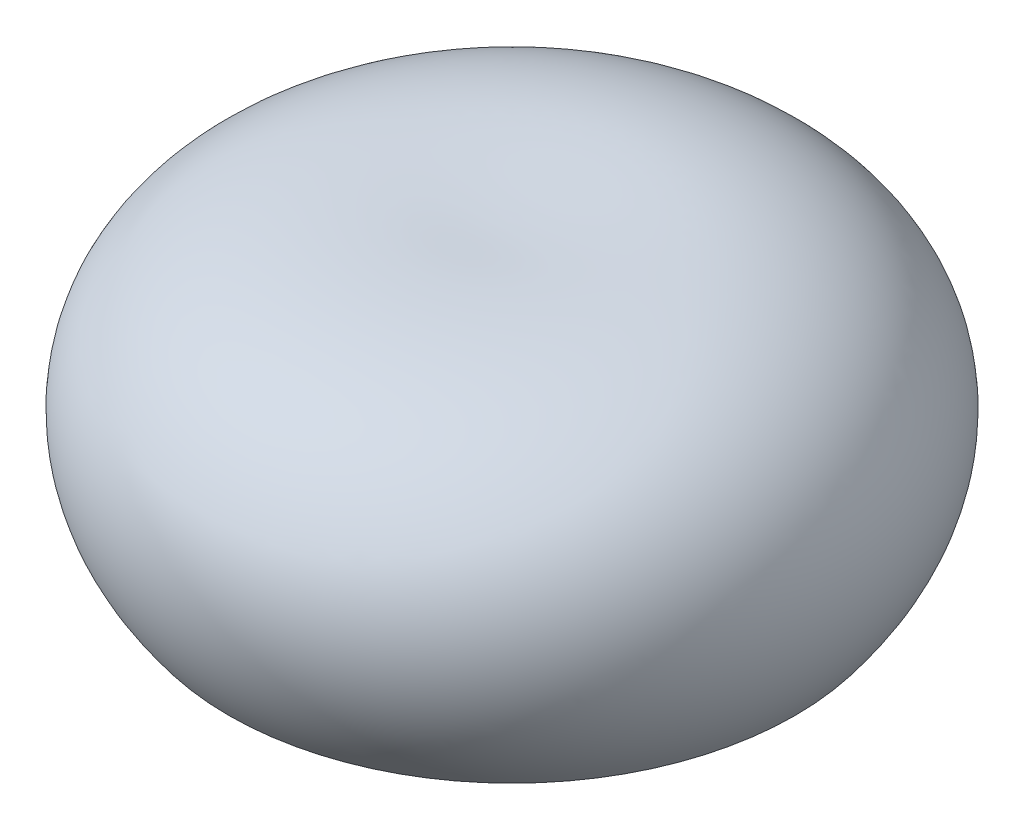
from build123d import *


with BuildPart() as part:
    # 草图1 → 旋转1 (revolve)
    with BuildSketch(Plane.XY):
        with BuildLine():
            Line((0, 7), (0, 0))
            Line((0, 0), (6.831441261, 0))
            add(Edge.make_bspline(
                [(0, 7), (0.073826027, 6.99961248), (0.178309524, 6.999064037), (0.306353289, 7.001245912), (0.380494798, 7.002863842), (0.441570297, 7.004497041), (0.495006805, 7.006121221), (0.543211062, 7.007739734), (0.587527277, 7.009349058), (0.628802834, 7.010947825), (0.667614606, 7.012534752), (0.704377034, 7.01410898), (0.739400045, 7.015669846), (0.772922733, 7.017216861), (0.805134201, 7.018749647), (0.83618711, 7.020267916), (0.866206819, 7.021771443), (0.895297775, 7.023260054), (0.923548095, 7.024733613), (0.951032931, 7.026192009), (0.977816991, 7.027635168), (1.003956462, 7.029063019), (1.029500501, 7.030475521), (1.054492406, 7.031872635), (1.078970545, 7.033254337), (1.10296911, 7.034620614), (1.126518722, 7.035971457), (1.149646932, 7.037306863), (1.172378634, 7.038626836), (1.194736407, 7.039931383), (1.216740809, 7.041220517), (1.238410615, 7.042494251), (1.25976303, 7.0437526), (1.280813862, 7.044995589), (1.301577678, 7.046223234), (1.322067936, 7.047435562), (1.342297094, 7.048632594), (1.362276717, 7.049814357), (1.382017559, 7.050980881), (1.401529643, 7.052132189), (1.420822325, 7.053268312), (1.439904357, 7.054389279), (1.458783938, 7.055495119), (1.477468763, 7.056585861), (1.495966064, 7.057661539), (1.514282646, 7.058722181), (1.532424926, 7.059767819), (1.550398957, 7.060798482), (1.568210462, 7.061814207), (1.585864853, 7.062815017), (1.603367259, 7.063800952), (1.62072254, 7.064772037), (1.637935314, 7.065728308), (1.655009966, 7.066669794), (1.671950667, 7.067596524), (1.68876139, 7.068508536), (1.705445919, 7.069405855), (1.722007866, 7.070288514), (1.738450677, 7.071156547), (1.754777643, 7.072009978), (1.770991912, 7.072848845), (1.787096497, 7.073673172), (1.803094282, 7.074482995), (1.81898803, 7.075278339), (1.834780391, 7.076059237), (1.850473907, 7.076825718), (1.86607102, 7.077577811), (1.881574075, 7.078315544), (1.896985327, 7.079038948), (1.912306943, 7.07974805), (1.927541011, 7.080442881), (1.94268954, 7.081123467), (1.957754466, 7.081789835), (1.972737654, 7.082442017), (1.987640906, 7.083080038), (2.002465956, 7.083703922), (2.017214482, 7.084313704), (2.031888102, 7.084909403), (2.046488381, 7.085491048), (2.06101683, 7.086058669), (2.075474911, 7.086612287), (2.089864039, 7.087151929), (2.104185584, 7.087677622), (2.118440871, 7.088189393), (2.132631183, 7.088687262), (2.146757765, 7.089171256), (2.160821822, 7.089641403), (2.174824525, 7.090097722), (2.188767006, 7.09054024), (2.202650367, 7.09096898), (2.216475676, 7.091383966), (2.23024397, 7.091785222), (2.243956256, 7.092172768), (2.257613513, 7.092546632), (2.271216693, 7.092906831), (2.284766719, 7.093253391), (2.298264492, 7.093586334), (2.311710885, 7.09390568), (2.32510675, 7.094211452), (2.338452915, 7.094503671), (2.351750186, 7.094782357), (2.364999348, 7.095047533), (2.378201166, 7.09529922), (2.391356385, 7.095537436), (2.404465731, 7.095762203), (2.417529911, 7.09597354), (2.430549615, 7.096171469), (2.443525516, 7.096356007), (2.45645827, 7.096527175), (2.469348518, 7.09668499), (2.482196883, 7.096829475), (2.495003975, 7.096960644), (2.50777039, 7.097078519), (2.520496708, 7.097183115), (2.533183498, 7.097274453), (2.545831313, 7.097352551), (2.558440695, 7.097417424), (2.571012173, 7.097469092), (2.583546264, 7.09750757), (2.596043474, 7.097532877), (2.608504298, 7.097545029), (2.620929218, 7.097544042), (2.633318709, 7.097529932), (2.64567323, 7.097502718), (2.657993237, 7.097462414), (2.67027917, 7.097409035), (2.682531464, 7.097342598), (2.694750544, 7.09726312), (2.706936823, 7.097170612), (2.719090708, 7.097065093), (2.731212598, 7.096946574), (2.743302883, 7.096815074), (2.755361945, 7.096670604), (2.767390158, 7.096513182), (2.779387888, 7.096342817), (2.791355496, 7.096159528), (2.803293333, 7.095963325), (2.815201745, 7.095754224), (2.827081071, 7.095532236), (2.838931641, 7.095297379), (2.850753782, 7.095049659), (2.862547814, 7.094789094), (2.874314048, 7.094515696), (2.886052794, 7.094229477), (2.89776435, 7.093930449), (2.909449014, 7.093618625), (2.921107076, 7.093294014), (2.932738821, 7.092956632), (2.944344528, 7.092606489), (2.955924471, 7.092243596), (2.967478921, 7.091867965), (2.979008141, 7.091479607), (2.990512392, 7.091078535), (3.001991929, 7.090664754), (3.013447002, 7.090238283), (3.024877857, 7.089799124), (3.036284736, 7.089347295), (3.047667878, 7.088882802), (3.059027515, 7.088405656), (3.070363877, 7.087915865), (3.081677189, 7.087413443), (3.092967672, 7.086898398), (3.104235546, 7.086370736), (3.115481023, 7.085830472), (3.126704315, 7.085277611), (3.137905628, 7.084712164), (3.149085165, 7.084134138), (3.160243127, 7.083543545), (3.171379711, 7.08294039), (3.18249511, 7.082324685), (3.193589514, 7.081696437), (3.204663111, 7.081055651), (3.215716085, 7.080402341), (3.226748617, 7.079736509), (3.237760886, 7.079058168), (3.248753066, 7.078367321), (3.25972533, 7.077663979), (3.270677849, 7.076948147), (3.28161079, 7.076219835), (3.292524317, 7.075479047), (3.303418592, 7.074725791), (3.314293774, 7.073960076), (3.325150021, 7.073181906), (3.335987487, 7.072391289), (3.346806324, 7.071588229), (3.357606682, 7.070772736), (3.368388709, 7.069944815), (3.379152549, 7.069104471), (3.389898346, 7.068251711), (3.40062624, 7.067386539), (3.411336371, 7.066508962), (3.422028874, 7.065618987), (3.432703885, 7.064716619), (3.443361536, 7.063801859), (3.454001959, 7.062874719), (3.46462528, 7.061935199), (3.475231627, 7.060983306), (3.485821126, 7.060019045), (3.496393899, 7.059042419), (3.506950067, 7.058053435), (3.51748975, 7.057052097), (3.528013066, 7.056038409), (3.53852013, 7.055012375), (3.549011057, 7.053973998), (3.559485961, 7.052923283), (3.569944951, 7.051860236), (3.580388137, 7.050784859), (3.590815628, 7.049697155), (3.60122753, 7.04859713), (3.611623946, 7.047484783), (3.622004982, 7.046360123), (3.632370739, 7.04522315), (3.642721317, 7.044073867), (3.653056816, 7.042912278), (3.663377333, 7.041738386), (3.673682964, 7.040552194), (3.683973805, 7.039353704), (3.694249949, 7.038142919), (3.704511488, 7.036919842), (3.714758514, 7.035684475), (3.724991116, 7.03443682), (3.735209383, 7.033176878), (3.745413403, 7.031904655), (3.75560326, 7.03062015), (3.765779041, 7.029323364), (3.775940829, 7.028014301), (3.786088707, 7.026692964), (3.796222756, 7.025359352), (3.806343057, 7.024013466), (3.816449688, 7.02265531), (3.826542729, 7.021284883), (3.836622256, 7.019902188), (3.846688346, 7.018507226), (3.856741073, 7.017099995), (3.866780512, 7.015680502), (3.876806735, 7.01424874), (3.886819815, 7.012804716), (3.896819824, 7.01134843), (3.90680683, 7.009879879), (3.916780903, 7.008399066), (3.926742113, 7.006905992), (3.936690524, 7.005400655), (3.946626205, 7.003883057), (3.956549222, 7.002353198), (3.966459637, 7.000811077), (3.976357517, 6.999256695), (3.986242922, 6.997690051), (3.996115917, 6.996111144), (4.005976561, 6.994519976), (4.015824916, 6.992916545), (4.02566104, 6.991300851), (4.035484994, 6.989672893), (4.045296834, 6.988032669), (4.055096619, 6.986380181), (4.064884405, 6.984715427), (4.074660248, 6.983038404), (4.084424202, 6.981349114), (4.094176323, 6.979647555), (4.103916663, 6.977933724), (4.113645276, 6.976207622), (4.123362214, 6.974469247), (4.133067528, 6.972718596), (4.142761269, 6.970955668), (4.152443487, 6.969180463), (4.162114232, 6.967392978), (4.171773552, 6.965593212), (4.181421496, 6.963781161), (4.191058111, 6.961956825), (4.200683444, 6.960120203), (4.210297541, 6.958271289), (4.219900448, 6.956410085), (4.229492209, 6.954536586), (4.239072869, 6.95265079), (4.248642473, 6.950752695), (4.258201062, 6.948842299), (4.267748681, 6.946919598), (4.277285369, 6.94498459), (4.286811171, 6.943037272), (4.296326125, 6.941077643), (4.305830272, 6.939105696), (4.315323653, 6.937121433), (4.324806306, 6.935124847), (4.334278271, 6.933115936), (4.343739584, 6.931094697), (4.353190285, 6.929061127), (4.36263041, 6.927015222), (4.372059995, 6.924956978), (4.381479078, 6.922886393), (4.390887692, 6.920803462), (4.400285874, 6.918708182), (4.409673658, 6.916600549), (4.419051079, 6.914480559), (4.42841817, 6.912348208), (4.437774964, 6.910203491), (4.447121494, 6.908046408), (4.456457791, 6.905876949), (4.465783889, 6.903695116), (4.475099817, 6.901500898), (4.484405608, 6.899294297), (4.493701291, 6.897075303), (4.502986897, 6.894843915), (4.512262455, 6.892600126), (4.521527995, 6.890343936), (4.530783544, 6.888075334), (4.540029131, 6.885794319), (4.549264784, 6.883500886), (4.55849053, 6.881195028), (4.567706398, 6.878876743), (4.576912412, 6.876546022), (4.5861086, 6.874202864), (4.595294987, 6.871847261), (4.604471599, 6.869479209), (4.61363846, 6.8670987), (4.622795596, 6.864705731), (4.63194303, 6.862300299), (4.641080787, 6.859882391), (4.65020889, 6.85745201), (4.659327362, 6.855009142), (4.668436227, 6.852553788), (4.677535505, 6.850085939), (4.686625221, 6.847605588), (4.695705394, 6.845112732), (4.704776047, 6.842607362), (4.713837201, 6.840089474), (4.722888876, 6.83755906), (4.731931092, 6.835016114), (4.740963871, 6.832460632), (4.74998723, 6.829892604), (4.75900119, 6.827312027), (4.768005769, 6.824718891), (4.777000986, 6.822113193), (4.785986859, 6.819494921), (4.794963407, 6.816864075), (4.803930647, 6.814220643), (4.812888596, 6.811564621), (4.821837272, 6.808895998), (4.830776691, 6.806214774), (4.839706869, 6.803520935), (4.848627822, 6.800814476), (4.857539568, 6.798095391), (4.866442119, 6.795363672), (4.875335493, 6.792619313), (4.884219704, 6.789862302), (4.893094767, 6.787092637), (4.901960695, 6.784310306), (4.910817504, 6.781515306), (4.919665205, 6.778707625), (4.928503814, 6.775887257), (4.937333343, 6.773054194), (4.946153805, 6.770208428), (4.954965213, 6.767349953), (4.963767579, 6.764478756), (4.972560915, 6.761594835), (4.981345232, 6.758698176), (4.990120543, 6.755788775), (4.998886858, 6.752866623), (5.007644188, 6.74993171), (5.016392546, 6.746984029), (5.025131939, 6.744023569), (5.033862379, 6.741050326), (5.042583876, 6.738064287), (5.051296439, 6.735065448), (5.060000077, 6.732053794), (5.068694801, 6.729029321), (5.077380618, 6.725992018), (5.086057538, 6.722941878), (5.094725569, 6.71987889), (5.103384718, 6.716803044), (5.112034995, 6.713714334), (5.120676405, 6.710612749), (5.129308958, 6.70749828), (5.137932659, 6.704370916), (5.146547516, 6.701230651), (5.155153537, 6.698077474), (5.163750726, 6.694911373), (5.17233909, 6.691732342), (5.180918636, 6.688540369), (5.189489369, 6.685335446), (5.198051295, 6.682117563), (5.206604418, 6.678886708), (5.215148744, 6.675642873), (5.223684278, 6.672386047), (5.232211025, 6.669116222), (5.240728988, 6.665833385), (5.249238171, 6.662537528), (5.25773858, 6.659228639), (5.266230218, 6.65590671), (5.274713087, 6.652571728), (5.283187193, 6.649223684), (5.291652536, 6.645862568), (5.300109121, 6.642488368), (5.308556949, 6.639101074), (5.316996024, 6.635700677), (5.325426348, 6.632287163), (5.333847922, 6.628860523), (5.342260749, 6.625420747), (5.350664829, 6.62196782), (5.359060165, 6.618501737), (5.367446757, 6.615022483), (5.375824607, 6.611530048), (5.384193715, 6.608024418), (5.392554082, 6.604505586), (5.400905709, 6.60097354), (5.409248594, 6.597428265), (5.417582739, 6.593869754), (5.425908142, 6.590297991), (5.434224804, 6.586712969), (5.442532724, 6.583114673), (5.450831901, 6.579503092), (5.459122334, 6.575878214), (5.467404022, 6.572240029), (5.475676964, 6.568588524), (5.483941157, 6.564923686), (5.492196599, 6.561245503), (5.50044329, 6.557553965), (5.508681226, 6.553849056), (5.516910406, 6.550130769), (5.525130826, 6.546399086), (5.533342485, 6.542653999), (5.541545379, 6.538895494), (5.549739504, 6.535123557), (5.557924857, 6.531338176), (5.566101436, 6.527539342), (5.574269235, 6.523727037), (5.582428252, 6.519901252), (5.590578482, 6.516061971), (5.598719922, 6.512209184), (5.606852565, 6.508342875), (5.61497641, 6.504463035), (5.623091449, 6.500569647), (5.631197678, 6.496662699), (5.639295091, 6.492742179), (5.647383684, 6.488808072), (5.655463452, 6.484860367), (5.663534387, 6.480899047), (5.671596486, 6.476924101), (5.679649739, 6.472935514), (5.687694144, 6.468933274), (5.695729692, 6.464917367), (5.703756377, 6.460887777), (5.711774192, 6.456844492), (5.71978313, 6.452787497), (5.727783185, 6.44871678), (5.735774348, 6.444632324), (5.743756613, 6.440534118), (5.751729971, 6.436422145), (5.759694415, 6.432296392), (5.767649937, 6.428156845), (5.775596528, 6.424003489), (5.783534181, 6.41983631), (5.791462886, 6.415655292), (5.799382636, 6.411460423), (5.807293419, 6.407251684), (5.81519523, 6.403029064), (5.823088058, 6.398792549), (5.830971892, 6.394542118), (5.838846725, 6.390277764), (5.846712546, 6.385999466), (5.854569345, 6.381707212), (5.862417112, 6.377400984), (5.870255837, 6.37308077), (5.878085509, 6.368746552), (5.885906118, 6.364398316), (5.893717654, 6.360036046), (5.901520105, 6.355659726), (5.90931346, 6.351269342), (5.917097708, 6.346864875), (5.924872839, 6.342446315), (5.932638837, 6.338013638), (5.940395695, 6.333566835), (5.948143398, 6.329105888), (5.955881936, 6.324630778), (5.963611296, 6.320141494), (5.971331465, 6.315638016), (5.97904243, 6.311120327), (5.98674418, 6.306588415), (5.994436701, 6.302042259), (6.002119979, 6.297481844), (6.009794004, 6.292907155), (6.017458758, 6.288318172), (6.02511423, 6.283714882), (6.032760407, 6.279097266), (6.040397273, 6.274465306), (6.048024816, 6.269818988), (6.05564302, 6.265158293), (6.06325187, 6.260483203), (6.070851354, 6.255793703), (6.078441456, 6.251089774), (6.08602216, 6.246371399), (6.093593452, 6.241638561), (6.101155317, 6.236891242), (6.108707739, 6.232129424), (6.116250702, 6.22735309), (6.123784191, 6.222562222), (6.13130819, 6.217756803), (6.138822681, 6.212936811), (6.146327653, 6.208102235), (6.153823082, 6.203253049), (6.161308958, 6.198389242), (6.16878526, 6.19351079), (6.176251974, 6.188617678), (6.183709081, 6.183709887), (6.191156565, 6.178787397), (6.198594407, 6.173850191), (6.206022591, 6.168898249), (6.213441098, 6.163931553), (6.220849911, 6.158950084), (6.228249012, 6.153953824), (6.235638381, 6.148942751), (6.243018001, 6.143916849), (6.250387854, 6.138876098), (6.25774792, 6.133820477), (6.26509818, 6.128749968), (6.272438616, 6.123664551), (6.279769208, 6.118564209), (6.287089935, 6.113448917), (6.294400781, 6.10831866), (6.301701724, 6.103173416), (6.308992744, 6.098013165), (6.316273821, 6.092837888), (6.323544934, 6.087647564), (6.330806063, 6.082442172), (6.33805719, 6.077221696), (6.345298289, 6.071986108), (6.352529345, 6.066735396), (6.359750331, 6.061469533), (6.36696123, 6.056188501), (6.374162017, 6.050892278), (6.381352675, 6.045580846), (6.388533176, 6.040254179), (6.395703504, 6.034912262), (6.402863633, 6.029555069), (6.410013542, 6.024182581), (6.417153208, 6.018794776), (6.424282608, 6.013391631), (6.431401721, 6.007973128), (6.438510521, 6.002539242), (6.445608988, 5.997089955), (6.452697094, 5.991625239), (6.459774821, 5.98614508), (6.466842141, 5.980649449), (6.473899031, 5.975138327), (6.480945468, 5.969611692), (6.487981427, 5.964069521), (6.495006884, 5.95851179), (6.502021813, 5.95293848), (6.50902619, 5.947349564), (6.51601999, 5.941745023), (6.523003188, 5.936124831), (6.529975758, 5.930488968), (6.536937674, 5.924837409), (6.543888912, 5.91917013), (6.550829444, 5.91348711), (6.557759247, 5.907788324), (6.56467829, 5.902073748), (6.57158655, 5.896343361), (6.578483999, 5.890597136), (6.585370611, 5.884835051), (6.592246357, 5.879057081), (6.599111213, 5.873263203), (6.605965148, 5.867453391), (6.612808137, 5.861627622), (6.619640151, 5.855785872), (6.626461162, 5.849928114), (6.633271142, 5.844054327), (6.640070062, 5.838164483), (6.646857895, 5.832258559), (6.65363461, 5.826336527), (6.66040018, 5.820398366), (6.667154576, 5.814444048), (6.673897766, 5.808473547), (6.680629723, 5.802486841), (6.687350415, 5.7964839), (6.694059815, 5.790464702), (6.700757891, 5.784429218), (6.707444612, 5.778377424), (6.714119949, 5.772309292), (6.72078387, 5.766224797), (6.727436346, 5.760123913), (6.734077343, 5.754006611), (6.740706832, 5.747872867), (6.747324779, 5.741722653), (6.753931155, 5.735555942), (6.760525926, 5.729372706), (6.767109061, 5.72317292), (6.773680527, 5.716956554), (6.780240291, 5.710723583), (6.786788322, 5.704473979), (6.793324585, 5.698207711), (6.799849047, 5.691924755), (6.806361676, 5.685625081), (6.812862436, 5.679308661), (6.819351296, 5.672975467), (6.82582822, 5.66662547), (6.832293173, 5.660258641), (6.838746122, 5.653874952), (6.845187032, 5.647474375), (6.851615868, 5.641056878), (6.858032594, 5.634622434), (6.864437176, 5.628171013), (6.870829578, 5.621702586), (6.877209762, 5.615217122), (6.883577694, 5.608714591), (6.889933338, 5.602194965), (6.896276656, 5.595658212), (6.902607613, 5.589104304), (6.908926169, 5.582533207), (6.915232291, 5.575944892), (6.921525938, 5.569339329), (6.927807074, 5.562716486), (6.93407566, 5.556076332), (6.940331659, 5.549418835), (6.946575032, 5.542743965), (6.95280574, 5.536051689), (6.959023744, 5.529341976), (6.965229006, 5.522614794), (6.971421487, 5.515870111), (6.977601144, 5.509107892), (6.983767942, 5.502328109), (6.989921836, 5.495530725), (6.996062789, 5.488715709), (7.00219076, 5.481883029), (7.008305706, 5.47503265), (7.014407587, 5.468164539), (7.020496364, 5.461278663), (7.026571991, 5.454374986), (7.03263443, 5.447453477), (7.038683638, 5.440514101), (7.04471957, 5.433556822), (7.050742184, 5.426581606), (7.056751441, 5.41958842), (7.062747294, 5.412577226), (7.0687297, 5.405547991), (7.074698615, 5.398500679), (7.080653997, 5.391435254), (7.086595799, 5.384351681), (7.092523978, 5.377249924), (7.09843849, 5.370129945), (7.104339288, 5.36299171), (7.110226328, 5.355835181), (7.116099562, 5.348660321), (7.121958947, 5.341467093), (7.127804434, 5.33425546), (7.133635978, 5.327025384), (7.139453534, 5.319776829), (7.145257051, 5.312509755), (7.151046484, 5.305224124), (7.156821783, 5.297919898), (7.162582904, 5.29059704), (7.168329793, 5.283255507), (7.174062407, 5.275895265), (7.179780693, 5.268516269), (7.185484603, 5.261118484), (7.19117409, 5.253701868), (7.196849099, 5.246266381), (7.202509584, 5.238811984), (7.208155493, 5.231338634), (7.213786775, 5.223846292), (7.219403379, 5.216334916), (7.225005254, 5.208804466), (7.230592346, 5.201254898), (7.236164607, 5.193686173), (7.24172198, 5.186098246), (7.247264415, 5.178491076), (7.252791858, 5.17086462), (7.258304256, 5.163218835), (7.263801554, 5.155553678), (7.269283698, 5.147869105), (7.274750635, 5.140165073), (7.280202309, 5.132441536), (7.285638665, 5.124698453), (7.291059647, 5.116935776), (7.296465199, 5.109153462), (7.301855266, 5.101351464), (7.307229789, 5.093529737), (7.312588712, 5.085688236), (7.31793198, 5.077826914), (7.323259529, 5.069945724), (7.328571308, 5.062044622), (7.333867255, 5.054123557), (7.339147311, 5.046182484), (7.344411415, 5.038221353), (7.349659511, 5.03024012), (7.354891536, 5.022238732), (7.360107432, 5.014217142), (7.365307135, 5.006175301), (7.370490586, 4.99811316), (7.375657723, 4.990030668), (7.380808483, 4.981927776), (7.385942803, 4.973804433), (7.39106062, 4.965660587), (7.396161874, 4.957496189), (7.401246496, 4.949311186), (7.406314425, 4.941105526), (7.411365595, 4.932879156), (7.416399942, 4.924632025), (7.4214174, 4.916364079), (7.426417902, 4.908075264), (7.431401383, 4.899765528), (7.436367773, 4.891434813), (7.441317009, 4.883083068), (7.44624902, 4.874710235), (7.451163738, 4.866316261), (7.456061095, 4.85790109), (7.460941021, 4.849464663), (7.465803446, 4.841006925), (7.470648302, 4.832527819), (7.475475515, 4.824027287), (7.480285016, 4.815505271), (7.485076733, 4.806961712), (7.48985059, 4.79839655), (7.494606521, 4.789809729), (7.499344447, 4.781201186), (7.504064297, 4.772570863), (7.508765993, 4.763918695), (7.513449467, 4.755244626), (7.518114636, 4.74654859), (7.522761429, 4.737830527), (7.527389767, 4.729090373), (7.531999574, 4.720328065), (7.536590772, 4.71154354), (7.541163283, 4.702736733), (7.545717027, 4.693907579), (7.550251926, 4.685056012), (7.5547679, 4.676181967), (7.559264867, 4.667285378), (7.563742748, 4.658366177), (7.568201459, 4.649424296), (7.572640919, 4.640459668), (7.577061042, 4.631472224), (7.581461751, 4.622461894), (7.585842955, 4.613428609), (7.590204571, 4.604372298), (7.594546516, 4.595292891), (7.5988687, 4.586190314), (7.603171038, 4.577064496), (7.607453444, 4.567915364), (7.611715826, 4.558742845), (7.615958098, 4.549546864), (7.620180171, 4.540327347), (7.624381949, 4.531084217), (7.628563348, 4.521817399), (7.632724272, 4.512526815), (7.63686463, 4.503212389), (7.640984331, 4.493874042), (7.645083274, 4.484511694), (7.649161372, 4.475125267), (7.653218524, 4.465714678), (7.657254638, 4.45627985), (7.661269612, 4.446820696), (7.665263355, 4.437337138), (7.66923576, 4.427829089), (7.673186735, 4.418296467), (7.677116175, 4.408739186), (7.68102398, 4.39915716), (7.68491005, 4.389550304), (7.688774278, 4.379918528), (7.692616567, 4.370261746), (7.696436804, 4.360579866), (7.700234889, 4.350872801), (7.704010715, 4.341140458), (7.707764174, 4.331382747), (7.711495158, 4.321599574), (7.715203559, 4.311790846), (7.718889263, 4.301956468), (7.722552163, 4.292096345), (7.726192146, 4.28221038), (7.729809098, 4.272298475), (7.733402908, 4.262360534), (7.736973454, 4.252396454), (7.740520629, 4.242406139), (7.744044308, 4.232389483), (7.747544379, 4.222346387), (7.751020719, 4.212276746), (7.754473208, 4.202180455), (7.757901727, 4.19205741), (7.76130615, 4.181907501), (7.764686357, 4.171730623), (7.76804222, 4.161526665), (7.771373615, 4.151295518), (7.774680415, 4.14103707), (7.77796249, 4.130751209), (7.781219711, 4.120437819), (7.784451948, 4.110096786), (7.787659069, 4.099727995), (7.79084094, 4.089331325), (7.793997427, 4.07890666), (7.797128393, 4.068453878), (7.800233702, 4.057972858), (7.803313213, 4.047463476), (7.80636679, 4.036925609), (7.809394288, 4.02635913), (7.812395566, 4.015763911), (7.815370481, 4.005139825), (7.818318884, 3.99448674), (7.821240631, 3.983804525), (7.824135572, 3.973093046), (7.827003555, 3.962352168), (7.829844432, 3.951581755), (7.832658048, 3.940781669), (7.835444246, 3.929951769), (7.838202873, 3.919091914), (7.84093377, 3.908201962), (7.843636775, 3.897281765), (7.846311728, 3.886331179), (7.848958465, 3.875350054), (7.851576822, 3.86433824), (7.854166632, 3.853295584), (7.856727724, 3.842221932), (7.859259931, 3.831117129), (7.861763079, 3.819981015), (7.864236993, 3.808813431), (7.866681497, 3.797614214), (7.869096413, 3.7863832), (7.87148156, 3.775120223), (7.873836757, 3.763825113), (7.876161817, 3.7524977), (7.878456556, 3.74113781), (7.880720784, 3.729745269), (7.882954312, 3.718319898), (7.885156942, 3.706861517), (7.887328483, 3.695369944), (7.889468735, 3.683844992), (7.891577499, 3.672286475), (7.893654571, 3.660694203), (7.895699747, 3.649067982), (7.897712819, 3.637407617), (7.899693575, 3.625712909), (7.901641805, 3.613983657), (7.903557292, 3.602219657), (7.905439817, 3.590420703), (7.907289162, 3.578586584), (7.9091051, 3.566717086), (7.910887405, 3.554811995), (7.912635851, 3.542871091), (7.914350199, 3.530894151), (7.91603022, 3.51888095), (7.917675669, 3.506831258), (7.91928631, 3.494744842), (7.920861894, 3.482621466), (7.922402172, 3.470460891), (7.923906896, 3.458262873), (7.925375808, 3.446027165), (7.92680865, 3.433753515), (7.928205158, 3.421441669), (7.92956507, 3.409091368), (7.930888111, 3.396702347), (7.93217401, 3.38427434), (7.93342249, 3.371807076), (7.934633269, 3.359300277), (7.935806061, 3.346753663), (7.936940577, 3.33416695), (7.93803652, 3.321539846), (7.939093596, 3.308872058), (7.940111499, 3.296163285), (7.941089923, 3.283413222), (7.942028554, 3.27062156), (7.942927078, 3.257787983), (7.943785171, 3.24491217), (7.944602506, 3.231993794), (7.945378752, 3.219032525), (7.946113571, 3.206028022), (7.946806622, 3.192979944), (7.947457556, 3.179887938), (7.948066016, 3.16675165), (7.948631649, 3.153570715), (7.949154083, 3.140344763), (7.949632952, 3.12707342), (7.950067874, 3.1137563), (7.950458468, 3.100393013), (7.950804339, 3.086983161), (7.951105095, 3.073526339), (7.951360327, 3.060022132), (7.951569625, 3.046470119), (7.951732574, 3.03286987), (7.95184874, 3.019220947), (7.951917698, 3.005522904), (7.951938999, 2.991775283), (7.951912198, 2.97797762), (7.951836834, 2.964129441), (7.951712443, 2.950230261), (7.951538547, 2.936279586), (7.951314664, 2.922276911), (7.951040298, 2.908221721), (7.950714946, 2.894113489), (7.950338097, 2.879951678), (7.949909224, 2.865735739), (7.949427798, 2.851465112), (7.948893271, 2.837139222), (7.948305089, 2.822757483), (7.947662685, 2.808319297), (7.946965479, 2.79382405), (7.946212881, 2.779271115), (7.945404291, 2.764659852), (7.944539088, 2.749989604), (7.943616644, 2.7352597), (7.942636317, 2.720469453), (7.941597449, 2.705618158), (7.940499368, 2.690705095), (7.939341388, 2.675729526), (7.938122804, 2.660690694), (7.936842898, 2.645587824), (7.935500935, 2.63042012), (7.934096162, 2.615186768), (7.932627806, 2.599886933), (7.931095082, 2.584519755), (7.929497177, 2.569084356), (7.927833264, 2.553579833), (7.926102496, 2.538005257), (7.924303998, 2.522359677), (7.922436881, 2.506642114), (7.920500227, 2.490851563), (7.918493099, 2.47498699), (7.91641453, 2.459047331), (7.914263532, 2.443031495), (7.912039084, 2.426938356), (7.909740147, 2.410766757), (7.90736564, 2.394515506), (7.904914466, 2.378183376), (7.902385483, 2.361769102), (7.899777529, 2.345271379), (7.897089394, 2.328688866), (7.894319846, 2.312020174), (7.891467606, 2.295263874), (7.888531363, 2.278418489), (7.885509757, 2.261482494), (7.882401395, 2.244454315), (7.879204834, 2.227332324), (7.875918587, 2.210114836), (7.872541115, 2.192800111), (7.86907083, 2.175386346), (7.865506094, 2.157871675), (7.861845206, 2.140254165), (7.858086412, 2.122531812), (7.854227894, 2.104702538), (7.850267765, 2.086764187), (7.846204078, 2.068714521), (7.842034806, 2.050551215), (7.837757848, 2.032271854), (7.833371027, 2.013873922), (7.828872075, 1.995354807), (7.824258639, 1.976711784), (7.819528268, 1.957942018), (7.814678413, 1.93904255), (7.809706418, 1.920010292), (7.804609514, 1.900842023), (7.79938481, 1.881534374), (7.794029295, 1.862083822), (7.788539812, 1.842486682), (7.782913068, 1.822739092), (7.777145613, 1.802837003), (7.771233831, 1.782776166), (7.765173932, 1.762552117), (7.758961935, 1.742160165), (7.752593661, 1.721595371), (7.746064711, 1.70085253), (7.73937045, 1.679926154), (7.732505999, 1.658810446), (7.725466197, 1.637499277), (7.718245598, 1.61598616), (7.710838434, 1.594264216), (7.70323859, 1.572326145), (7.695439582, 1.550164183), (7.68743451, 1.527770068), (7.679216032, 1.505134986), (7.670776315, 1.482249523), (7.662106992, 1.459103603), (7.653199103, 1.435686425), (7.644043042, 1.411986383), (7.634628477, 1.387990983), (7.624944284, 1.363686743), (7.614978446, 1.33905908), (7.604717954, 1.314092184), (7.594148689, 1.28876886), (7.583255271, 1.263070361), (7.572020914, 1.236976177), (7.560427217, 1.210463798), (7.548453948, 1.18350843), (7.536078766, 1.156082653), (7.52327691, 1.128156017), (7.510020795, 1.099694549), (7.496279544, 1.070660156), (7.482018409, 1.041009885), (7.467198033, 1.010695011), (7.451773557, 0.979659882), (7.43569345, 0.947840457), (7.418898027, 0.915162416), (7.401317504, 0.88153868), (7.382869392, 0.846866107), (7.363454982, 0.811020992), (7.342954436, 0.773852795), (7.321219775, 0.735175152), (7.298064541, 0.694752576), (7.273247917, 0.652279979), (7.246449153, 0.607349576), (7.217223809, 0.559393937), (7.184922391, 0.507579711), (7.148521469, 0.450584621), (7.106203239, 0.386040398), (7.053928975, 0.3085951), (6.962588145, 0.177853211), (6.88558457, 0.073425773), (6.831441261, 0)],
                knots=[0, 0, 0, 0, 0.016508251, 0.023363574, 0.028636216, 0.033091617, 0.037025983, 0.04059109, 0.04387702, 0.046942414, 0.049827967, 0.052563282, 0.055170689, 0.057667517, 0.060067538, 0.062381906, 0.064619804, 0.066788902, 0.068895681, 0.070945675, 0.072943656, 0.07489377, 0.076799649, 0.078664492, 0.080491139, 0.082282118, 0.084039697, 0.085765916, 0.087462619, 0.08913148, 0.090774023, 0.092391639, 0.093985605, 0.095557094, 0.097107186, 0.09863688, 0.1001471, 0.101638706, 0.103112495, 0.104569211, 0.10600955, 0.107434162, 0.108843656, 0.110238603, 0.111619541, 0.112986976, 0.114341384, 0.115683217, 0.117012898, 0.118330831, 0.119637397, 0.120932958, 0.122217857, 0.123492421, 0.12475696, 0.126011769, 0.127257131, 0.128493315, 0.129720577, 0.130939162, 0.132149305, 0.13335123, 0.134545153, 0.13573128, 0.136909808, 0.138080926, 0.139244818, 0.140401657, 0.141551613, 0.142694847, 0.143831516, 0.144961768, 0.14608575, 0.1472036, 0.148315453, 0.14942144, 0.150521684, 0.151616309, 0.15270543, 0.153789161, 0.154867612, 0.155940888, 0.157009093, 0.158072325, 0.159130682, 0.160184256, 0.161233138, 0.162277417, 0.163317176, 0.1643525, 0.165383468, 0.166410158, 0.167432647, 0.168451008, 0.169465312, 0.17047563, 0.17148203, 0.172484577, 0.173483335, 0.174478368, 0.175469736, 0.176457499, 0.177441714, 0.178422438, 0.179399726, 0.180373632, 0.181344207, 0.182311504, 0.183275571, 0.184236458, 0.185194213, 0.18614888, 0.187100506, 0.188049136, 0.188994811, 0.189937576, 0.19087747, 0.191814535, 0.192748809, 0.193680333, 0.194609143, 0.195535276, 0.19645877, 0.197379659, 0.198297978, 0.199213761, 0.200127042, 0.201037853, 0.201946226, 0.202852193, 0.203755784, 0.204657029, 0.205555959, 0.206452602, 0.207346986, 0.208239139, 0.209129089, 0.210016863, 0.210902486, 0.211785985, 0.212667385, 0.213546711, 0.214423987, 0.215299238, 0.216172487, 0.217043757, 0.217913071, 0.218780451, 0.219645919, 0.220509497, 0.221371207, 0.222231068, 0.223089102, 0.223945328, 0.224799767, 0.225652438, 0.22650336, 0.227352552, 0.228200033, 0.22904582, 0.229889932, 0.230732387, 0.231573202, 0.232412394, 0.23324998, 0.234085976, 0.234920399, 0.235753266, 0.236584591, 0.237414391, 0.23824268, 0.239069475, 0.23989479, 0.240718639, 0.241541037, 0.242361999, 0.243181539, 0.24399967, 0.244816406, 0.245631761, 0.246445748, 0.247258379, 0.248069669, 0.248879629, 0.249688273, 0.250495612, 0.251301659, 0.252106427, 0.252909926, 0.253712168, 0.254513166, 0.255312931, 0.256111473, 0.256908805, 0.257704937, 0.25849988, 0.259293644, 0.260086241, 0.26087768, 0.261667972, 0.262457128, 0.263245156, 0.264032068, 0.264817873, 0.265602581, 0.266386201, 0.267168742, 0.267950215, 0.268730627, 0.26950999, 0.27028831, 0.271065598, 0.271841862, 0.272617111, 0.273391353, 0.274164597, 0.274936852, 0.275708125, 0.276478425, 0.277247759, 0.278016137, 0.278783566, 0.279550053, 0.280315607, 0.281080235, 0.281843945, 0.282606744, 0.283368639, 0.284129639, 0.28488975, 0.28564898, 0.286407335, 0.287164823, 0.287921451, 0.288677225, 0.289432153, 0.290186241, 0.290939495, 0.291691923, 0.292443531, 0.293194325, 0.293944313, 0.294693499, 0.295441891, 0.296189495, 0.296936317, 0.297682363, 0.298427639, 0.29917215, 0.299915904, 0.300658906, 0.301401162, 0.302142677, 0.302883457, 0.303623508, 0.304362835, 0.305101445, 0.305839342, 0.306576532, 0.30731302, 0.308048812, 0.308783913, 0.309518328, 0.310252063, 0.310985123, 0.311717512, 0.312449236, 0.3131803, 0.313910709, 0.314640467, 0.31536958, 0.316098053, 0.316825891, 0.317553097, 0.318279677, 0.319005636, 0.319730978, 0.320455708, 0.321179831, 0.32190335, 0.322626271, 0.323348598, 0.324070336, 0.324791488, 0.32551206, 0.326232055, 0.326951478, 0.327670332, 0.328388624, 0.329106355, 0.329823532, 0.330540157, 0.331256236, 0.331971771, 0.332686767, 0.333401229, 0.334115159, 0.334828562, 0.335541443, 0.336253804, 0.33696565, 0.337676984, 0.338387811, 0.339098134, 0.339807957, 0.340517283, 0.341226117, 0.341934462, 0.342642321, 0.343349699, 0.344056599, 0.344763024, 0.345468979, 0.346174466, 0.346879489, 0.347584052, 0.348288158, 0.34899181, 0.349695012, 0.350397768, 0.351100081, 0.351801953, 0.352503389, 0.353204392, 0.353904965, 0.354605111, 0.355304834, 0.356004137, 0.356703023, 0.357401495, 0.358099556, 0.35879721, 0.35949446, 0.360191309, 0.360887759, 0.361583815, 0.362279479, 0.362974754, 0.363669643, 0.36436415, 0.365058277, 0.365752027, 0.366445403, 0.367138409, 0.367831047, 0.36852332, 0.369215231, 0.369906783, 0.370597978, 0.37128882, 0.371979312, 0.372669456, 0.373359255, 0.374048713, 0.374737831, 0.375426612, 0.37611506, 0.376803177, 0.377490966, 0.37817843, 0.378865571, 0.379552391, 0.380238895, 0.380925084, 0.381610961, 0.382296529, 0.38298179, 0.383666747, 0.384351403, 0.385035761, 0.385719822, 0.386403589, 0.387087066, 0.387770254, 0.388453157, 0.389135776, 0.389818115, 0.390500176, 0.391181961, 0.391863473, 0.392544714, 0.393225687, 0.393906395, 0.39458684, 0.395267024, 0.39594695, 0.39662662, 0.397306037, 0.397985203, 0.398664121, 0.399342793, 0.400021221, 0.400699408, 0.401377357, 0.402055069, 0.402732547, 0.403409794, 0.404086811, 0.404763602, 0.405440168, 0.406116513, 0.406792637, 0.407468544, 0.408144236, 0.408819716, 0.409494985, 0.410170046, 0.410844901, 0.411519553, 0.412194003, 0.412868255, 0.41354231, 0.414216171, 0.41488984, 0.415563319, 0.416236611, 0.416909718, 0.417582642, 0.418255385, 0.41892795, 0.419600339, 0.420272553, 0.420944597, 0.42161647, 0.422288177, 0.422959719, 0.423631098, 0.424302316, 0.424973377, 0.425644281, 0.426315032, 0.426985631, 0.42765608, 0.428326383, 0.42899654, 0.429666555, 0.430336429, 0.431006165, 0.431675764, 0.43234523, 0.433014564, 0.433683769, 0.434352845, 0.435021797, 0.435690626, 0.436359334, 0.437027923, 0.437696396, 0.438364755, 0.439033001, 0.439701138, 0.440369167, 0.44103709, 0.44170491, 0.442372628, 0.443040248, 0.443707771, 0.444375199, 0.445042534, 0.445709779, 0.446376936, 0.447044007, 0.447710995, 0.4483779, 0.449044726, 0.449711475, 0.450378149, 0.451044749, 0.451711279, 0.452377741, 0.453044136, 0.453710466, 0.454376735, 0.455042944, 0.455709095, 0.456375191, 0.457041233, 0.457707224, 0.458373167, 0.459039062, 0.459704913, 0.460370722, 0.46103649, 0.461702221, 0.462367916, 0.463033577, 0.463699207, 0.464364808, 0.465030382, 0.465695931, 0.466361458, 0.467026964, 0.467692453, 0.468357925, 0.469023384, 0.469688832, 0.47035427, 0.471019702, 0.471685129, 0.472350554, 0.473015978, 0.473681405, 0.474346836, 0.475012273, 0.47567772, 0.476343178, 0.477008649, 0.477674136, 0.478339641, 0.479005166, 0.479670714, 0.480336286, 0.481001886, 0.481667516, 0.482333177, 0.482998872, 0.483664604, 0.484330375, 0.484996187, 0.485662042, 0.486327943, 0.486993892, 0.487659892, 0.488325944, 0.488992052, 0.489658218, 0.490324443, 0.490990731, 0.491657084, 0.492323504, 0.492989993, 0.493656555, 0.494323191, 0.494989904, 0.495656696, 0.49632357, 0.496990528, 0.497657573, 0.498324707, 0.498991932, 0.499659252, 0.500326668, 0.500994183, 0.5016618, 0.502329521, 0.502997348, 0.503665285, 0.504333333, 0.505001496, 0.505669775, 0.506338174, 0.507006695, 0.50767534, 0.508344112, 0.509013014, 0.509682049, 0.510351218, 0.511020525, 0.511689972, 0.512359562, 0.513029297, 0.513699181, 0.514369215, 0.515039403, 0.515709747, 0.516380251, 0.517050916, 0.517721745, 0.518392742, 0.519063908, 0.519735248, 0.520406763, 0.521078456, 0.52175033, 0.522422388, 0.523094633, 0.523767067, 0.524439694, 0.525112516, 0.525785536, 0.526458757, 0.527132183, 0.527805815, 0.528479657, 0.529153711, 0.529827982, 0.530502471, 0.531177181, 0.531852116, 0.532527279, 0.533202673, 0.5338783, 0.534554164, 0.535230268, 0.535906615, 0.536583208, 0.53726005, 0.537937144, 0.538614493, 0.539292101, 0.539969971, 0.540648106, 0.541326508, 0.542005183, 0.542684131, 0.543363358, 0.544042865, 0.544722657, 0.545402737, 0.546083107, 0.546763772, 0.547444735, 0.548125999, 0.548807567, 0.549489443, 0.55017163, 0.550854132, 0.551536953, 0.552220095, 0.552903562, 0.553587358, 0.554271486, 0.55495595, 0.555640753, 0.5563259, 0.557011393, 0.557697236, 0.558383433, 0.559069988, 0.559756904, 0.560444185, 0.561131835, 0.561819858, 0.562508256, 0.563197035, 0.563886198, 0.564575749, 0.565265692, 0.56595603, 0.566646768, 0.567337909, 0.568029458, 0.568721418, 0.569413794, 0.570106589, 0.570799808, 0.571493455, 0.572187533, 0.572882048, 0.573577002, 0.574272401, 0.574968249, 0.575664549, 0.576361306, 0.577058525, 0.57775621, 0.578454364, 0.579152994, 0.579852102, 0.580551693, 0.581251772, 0.581952344, 0.582653412, 0.583354982, 0.584057058, 0.584759644, 0.585462746, 0.586166368, 0.586870514, 0.58757519, 0.5882804, 0.588986149, 0.589692442, 0.590399283, 0.591106678, 0.591814632, 0.592523149, 0.593232235, 0.593941895, 0.594652133, 0.595362955, 0.596074366, 0.596786371, 0.597498975, 0.598212184, 0.598926003, 0.599640438, 0.600355493, 0.601071174, 0.601787486, 0.602504436, 0.603222028, 0.603940268, 0.604659162, 0.605378715, 0.606098933, 0.606819822, 0.607541388, 0.608263636, 0.608986572, 0.609710203, 0.610434533, 0.61115957, 0.611885319, 0.612611786, 0.613338978, 0.6140669, 0.61479556, 0.615524962, 0.616255114, 0.616986021, 0.617717691, 0.61845013, 0.619183344, 0.619917339, 0.620652124, 0.621387703, 0.622124085, 0.622861275, 0.623599281, 0.624338109, 0.625077767, 0.625818261, 0.626559598, 0.627301787, 0.628044833, 0.628788745, 0.629533529, 0.630279192, 0.631025743, 0.631773189, 0.632521537, 0.633270795, 0.634020971, 0.634772072, 0.635524106, 0.636277082, 0.637031006, 0.637785888, 0.638541735, 0.639298555, 0.640056357, 0.640815149, 0.641574939, 0.642335736, 0.643097548, 0.643860385, 0.644624254, 0.645389164, 0.646155124, 0.646922144, 0.647690232, 0.648459398, 0.649229649, 0.650000997, 0.65077345, 0.651547017, 0.652321708, 0.653097533, 0.653874501, 0.654652623, 0.655431908, 0.656212365, 0.656994006, 0.657776841, 0.658560879, 0.659346131, 0.660132607, 0.660920319, 0.661709277, 0.662499491, 0.663290972, 0.664083733, 0.664877782, 0.665673133, 0.666469796, 0.667267783, 0.668067105, 0.668867774, 0.669669802, 0.670473201, 0.671277983, 0.67208416, 0.672891744, 0.673700749, 0.674511186, 0.675323068, 0.676136408, 0.67695122, 0.677767515, 0.678585309, 0.679404613, 0.680225443, 0.68104781, 0.68187173, 0.682697217, 0.683524283, 0.684352945, 0.685183217, 0.686015112, 0.686848647, 0.687683836, 0.688520694, 0.689359237, 0.690199481, 0.69104144, 0.691885132, 0.692730572, 0.693577776, 0.694426762, 0.695277545, 0.696130143, 0.696984574, 0.697840853, 0.698699, 0.699559031, 0.700420965, 0.70128482, 0.702150614, 0.703018367, 0.703888097, 0.704759824, 0.705633566, 0.706509344, 0.707387177, 0.708267086, 0.709149092, 0.710033215, 0.710919476, 0.711807896, 0.712698498, 0.713591303, 0.714486333, 0.715383612, 0.716283161, 0.717185005, 0.718089166, 0.718995668, 0.719904537, 0.720815795, 0.721729469, 0.722645583, 0.723564164, 0.724485237, 0.725408828, 0.726334966, 0.727263675, 0.728194986, 0.729128925, 0.730065521, 0.731004803, 0.7319468, 0.732891544, 0.733839062, 0.734789388, 0.735742552, 0.736698585, 0.737657521, 0.738619392, 0.739584232, 0.740552074, 0.741522955, 0.742496908, 0.743473969, 0.744454175, 0.745437564, 0.746424172, 0.747414039, 0.748407202, 0.749403704, 0.750403582, 0.75140688, 0.752413639, 0.753423901, 0.754437711, 0.755455113, 0.756476152, 0.757500875, 0.758529328, 0.759561559, 0.760597618, 0.761637555, 0.762681419, 0.763729264, 0.764781142, 0.765837108, 0.766897216, 0.767961524, 0.769030088, 0.770102968, 0.771180223, 0.772261915, 0.773348108, 0.774438865, 0.775534251, 0.776634335, 0.777739184, 0.778848869, 0.779963461, 0.781083035, 0.782207666, 0.783337431, 0.784472409, 0.785612681, 0.786758331, 0.787909442, 0.789066103, 0.790228404, 0.791396435, 0.792570292, 0.793750071, 0.794935871, 0.796127795, 0.797325948, 0.798530437, 0.799741374, 0.800958872, 0.802183049, 0.803414025, 0.804651926, 0.805896879, 0.807149016, 0.808408474, 0.809675392, 0.810949915, 0.812232194, 0.813522381, 0.814820636, 0.816127124, 0.817442016, 0.818765486, 0.820097718, 0.8214389, 0.822789227, 0.824148902, 0.825518134, 0.826897142, 0.828286152, 0.829685398, 0.831095124, 0.832515586, 0.833947046, 0.835389779, 0.836844074, 0.838310228, 0.839788554, 0.841279378, 0.84278304, 0.844299896, 0.84583032, 0.847374703, 0.848933455, 0.850507006, 0.852095808, 0.853700338, 0.855321097, 0.856958612, 0.858613442, 0.860286175, 0.861977436, 0.863687885, 0.865418223, 0.867169194, 0.868941592, 0.87073626, 0.872554101, 0.874396079, 0.876263228, 0.878156657, 0.880077562, 0.88202723, 0.884007054, 0.886018541, 0.888063331, 0.890143212, 0.892260136, 0.894416246, 0.896613899, 0.898855701, 0.901144543, 0.903483648, 0.905876625, 0.908327542, 0.910841004, 0.913422269, 0.916077374, 0.918813316, 0.921638278, 0.924561926, 0.927595825, 0.930754002, 0.934053748, 0.937516794, 0.9411711, 0.945053679, 0.94921533, 0.953729132, 0.958707135, 0.964337724, 0.970987573, 0.979600573, 1, 1, 1, 1], degree=3))
        make_face()
    revolve(axis=Axis((0, 7, 0), (0, -1, 0)))

    # 草图2 → 切除-旋转1 (revolve, cut)
    with BuildSketch(Plane.XZ):
        with BuildLine():
            Line((0, 1.5), (0, -1.5))
            ThreePointArc((0, -1.5), (1.5, 0), (0, 1.5))
        make_face()
    revolve(axis=Axis((0, 0, 1.5), (0, 0, -1)), mode=Mode.SUBTRACT)


solid = part.part
